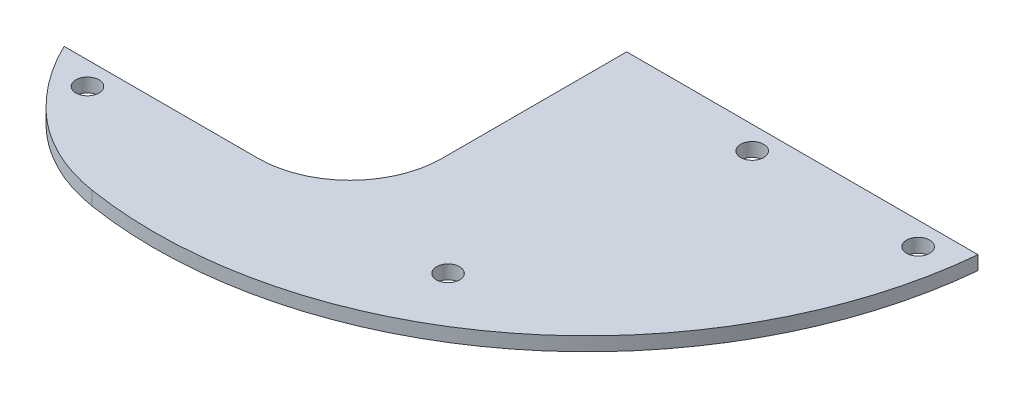
from build123d import *

# Parameters (mm, degrees)
PCB_BOARD_DEPTH     = 0.75
BOSS_EXTRUDE1_DEPTH = 1.5
SKETCH5_R           = 1.25
MOUTING_HOLES_DEPTH = 10


with BuildPart() as part:
    # Sketch1 → Pcb Board (new, symmetric)
    with BuildSketch(Plane(origin=(0, 0, 0), x_dir=(1, 0, 0), z_dir=(0, 1, 0))):
        with BuildLine():
            ThreePointArc((-33.016678433, -25.226747869), (3.126055598, -15.93137563), (21.101274409, 16.773252131))
            Line((21.101274409, 16.773252131), (-17.016678433, 16.773252131))
            Line((-17.016678433, 16.773252131), (-17.016678433, -3.226747869))
            ThreePointArc((-17.016678433, -3.226747869), (-19.945610621, -10.297815681), (-27.016678433, -13.226747869))
            Line((-27.016678433, -13.226747869), (-43.016678433, -13.226747869))
            Line((-43.016678433, -13.226747869), (-43.016678432, -20.226747869))
            ThreePointArc((-43.016678433, -20.226747869), (-38.403625629, -23.500642262), (-33.016678433, -25.226747869))
        make_face()
    extrude(amount=PCB_BOARD_DEPTH, both=True)

    # Sketch6 → Boss-Extrude1 (add)
    with BuildSketch(Plane(origin=(0, 0.75, 0), x_dir=(1, 0, 0), z_dir=(0, 1, 0))):
        with BuildLine():
            Line((-43.016678433, -13.226747869), (-48.055127106, -13.226747869))
            ThreePointArc((-48.055127106, -13.226747869), (-45.844966452, -16.949205227), (-43.016678433, -20.226747869))
            Line((-43.016678433, -20.226747869), (-43.016678433, -13.226747869))
        make_face()
    extrude(amount=-BOSS_EXTRUDE1_DEPTH)

    # Sketch5 → Mouting Holes (cut)
    with BuildSketch(Plane(origin=(0, 0.75, 0), x_dir=(1, 0, 0), z_dir=(0, 1, 0))):
        with Locations(Location((-43.016678433, -15.726747869, 0), (0, 0, 270))):
            Circle(SKETCH5_R)
        with Locations(Location((17.101274409, 14.273252131, 0), (0, 0, 270))):
            Circle(SKETCH5_R)
        with Locations(Location((-5.898725591, -13.726747869, 0), (0, 0, 270))):
            Circle(SKETCH5_R)
        with Locations(Location((-0.898725591, 14.273252131, 0), (0, 0, 270))):
            Circle(SKETCH5_R)
    extrude(amount=-MOUTING_HOLES_DEPTH, mode=Mode.SUBTRACT)


solid = part.part
